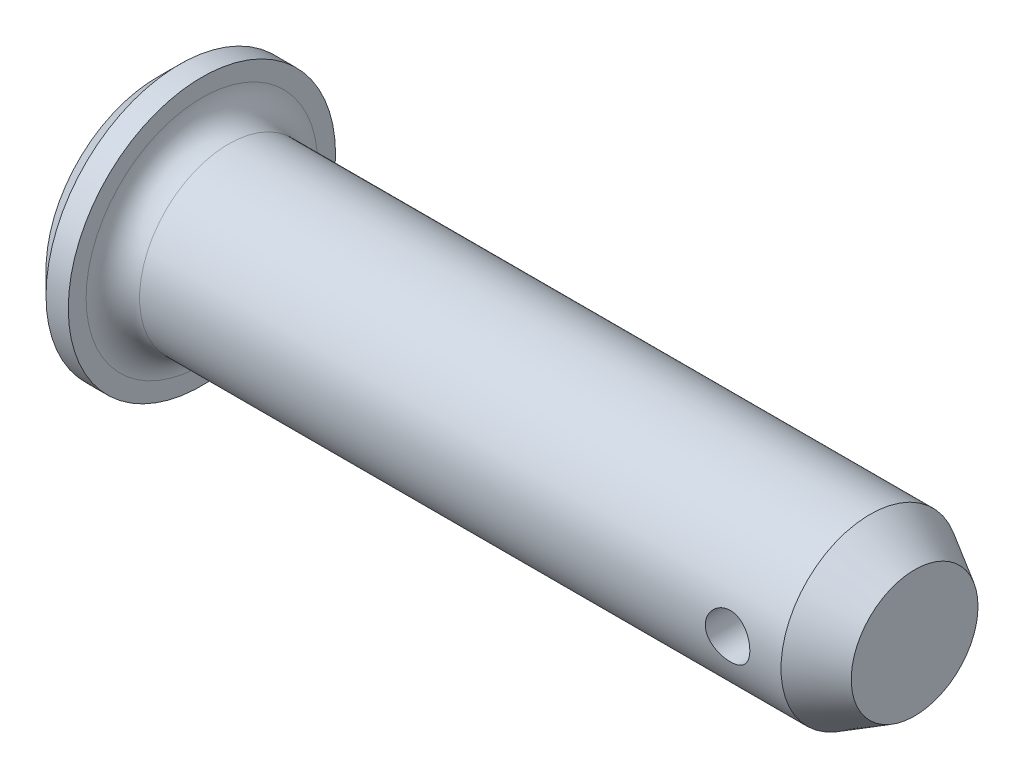
from build123d import *

# Parameters (mm, degrees)
CUT_EXTRUDE_1_DEPTH      = 18.521415468
CUT_EXTRUDE_1_DEPTH_BACK = 18.521415468
SKETCH_2_R               = 0.5
FILLET_1_R               = 0.6
CHAMFER_1_SIZE           = 1
CHAMFER_1_SIZE2          = 0.577350269


with BuildPart() as part:
    # 草图1 → Revolve 549 (revolve)
    with BuildSketch(Plane.XY, mode=Mode.PRIVATE) as revolve_549_sk:
        Polygon((0, 0), (17, 0), (17, 2), (1, 2), (1, 3), (0.5, 3), (0, 2.5), align=None)
    revolve(revolve_549_sk.sketch.rotate(Axis((0, 0, 0), (-1, 0, 0)), 90), axis=Axis((0, 0, 0), (-1, 0, 0)))

    # 草图2 → 切除-拉伸1 (cut, two sides: drawn at the far end of the back side and taken through both)
    with BuildSketch(Plane.XY.offset(-CUT_EXTRUDE_1_DEPTH_BACK)):
        with Locations((14.8, 0)):
            Circle(SKETCH_2_R)
    extrude(amount=CUT_EXTRUDE_1_DEPTH + CUT_EXTRUDE_1_DEPTH_BACK, mode=Mode.SUBTRACT)

    # 圆角1
    fillet_1_edges = [part.edges().sort_by_distance(p)[0] for p in [
        (1, 0, 2),
    ]]
    fillet(fillet_1_edges, radius=FILLET_1_R)

    # 倒角1
    chamfer_1_edges = [part.edges().sort_by_distance(p)[0] for p in [
        (17, 0, 2),
    ]]
    chamfer_1_side = [part.faces().sort_by_distance(p)[0] for p in [
        (9.3, 0, 2),
    ]]
    chamfer(chamfer_1_edges, length=CHAMFER_1_SIZE, length2=CHAMFER_1_SIZE2, reference=chamfer_1_side[0])


solid = part.part
